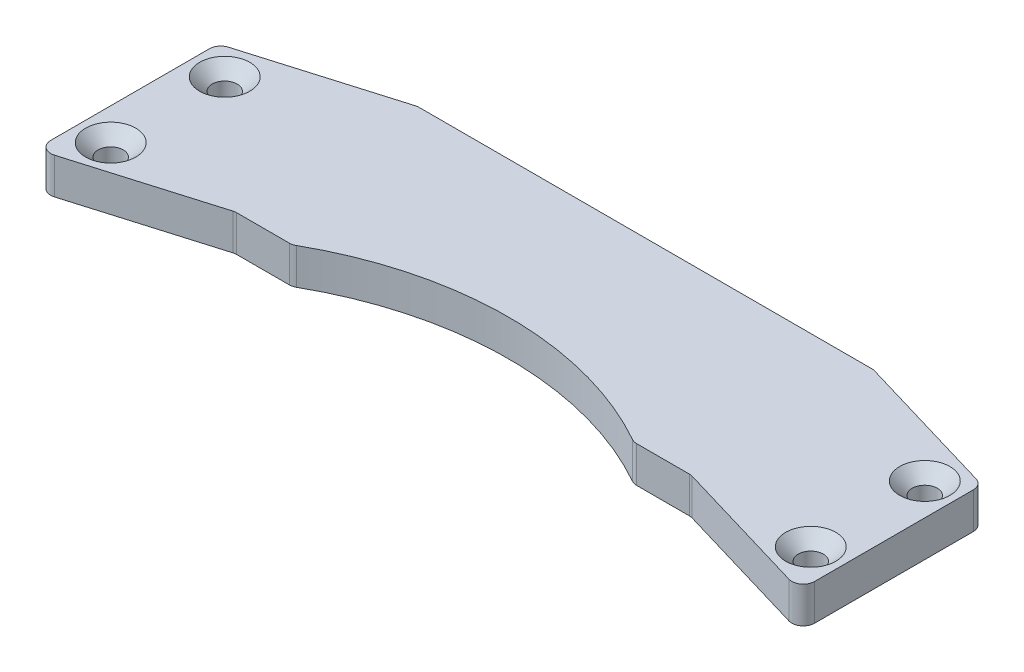
from build123d import *

# Parameters (mm, degrees)
BOSS_EXTRUDE1_DEPTH                             = 3.175
CSK_FOR_M2_FLAT_HEAD_MACHINE_SCREW1_D           = 2.2
CSK_FOR_M2_FLAT_HEAD_MACHINE_SCREW1_CSINK_D     = 4.4
CSK_FOR_M2_FLAT_HEAD_MACHINE_SCREW1_CSINK_ANGLE = 90
SKETCH5_R                                       = 30
CUT_EXTRUDE2_DEPTH                              = 40.144994891
FILLET1_R                                       = 1


with BuildPart() as part:
    # Sketch1 → Boss-Extrude1 (new body)
    with BuildSketch(Plane(origin=(0, 0, 0), x_dir=(1, 0, 0), z_dir=(0, 1, 0))):
        Polygon((-33.5, 0), (-33.5, 16), (-20, 20), (0, 20), (0, 4), (-20, 4), align=None)
    extrude(amount=BOSS_EXTRUDE1_DEPTH)

    # CSK for M2 Flat Head Machine Screw1 (through all)
    with Locations(Plane(origin=(0, 3.175, 0), x_dir=(1, 0, 0), z_dir=(0, 1, 0))):
        with Locations((-30.7, 13.8), (-30.7, 3.8)):
            CounterSinkHole(CSK_FOR_M2_FLAT_HEAD_MACHINE_SCREW1_D / 2, CSK_FOR_M2_FLAT_HEAD_MACHINE_SCREW1_CSINK_D / 2, counter_sink_angle=CSK_FOR_M2_FLAT_HEAD_MACHINE_SCREW1_CSINK_ANGLE)

    # Mirror1: part across plane


with BuildPart() as part_1:
    add(part.part)
    add(part.part.mirror(Plane(origin=(0, 0, 0), x_dir=(0, 0, 1), z_dir=(1, 0, 0))))

    # Sketch5 → Cut-Extrude2 (cut, through all)
    with BuildSketch(Plane(origin=(0, 3.175, 0), x_dir=(1, 0, 0), z_dir=(0, 1, 0))):
        with Locations((0, -22)):
            Circle(SKETCH5_R)
    extrude(amount=-CUT_EXTRUDE2_DEPTH, mode=Mode.SUBTRACT)

    # Fillet1
    fillet1_edges = [part_1.edges().sort_by_distance(p)[0] for p in [
        (-20, 1.5875, -4),
        (-33.5, 1.5875, 0),
        (-33.5, 1.5875, -16),
        (-20, 1.5875, -20),
        (20, 1.5875, -20),
        (33.5, 1.5875, -16),
        (33.5, 1.5875, 0),
        (20, 1.5875, -4),
        (-14.966629547, 1.5875, -4),
        (14.966629547, 1.5875, -4),
    ]]
    fillet(fillet1_edges, radius=FILLET1_R)


solid = part_1.part
